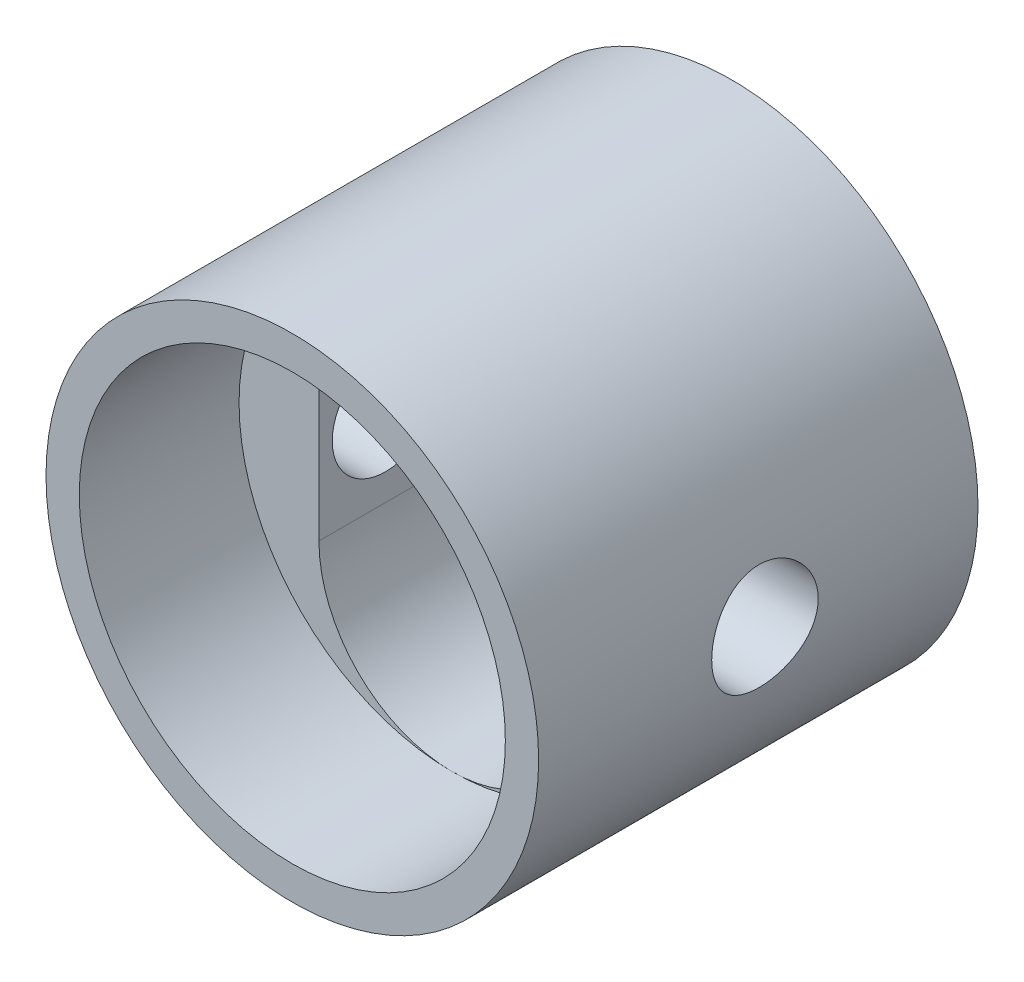
from build123d import *

# Parameters (mm, degrees)
ESQUISSE1_R             = 9.25
BASE_EXTRUSION_DEPTH    = 16.5
ESQUISSE2_R             = 2
ENL_V_MAT_EXTRU_1_DEPTH = 27.458694223
ESQUISSE3_R             = 8
ENL_V_MAT_EXTRU_2_DEPTH = 6
ENL_V_MAT_EXTRU_3_DEPTH = 10


with BuildPart() as part:
    # Esquisse1 → Base-Extrusion (new body)
    with BuildSketch(Plane.XY):
        Circle(ESQUISSE1_R)
    extrude(amount=BASE_EXTRUSION_DEPTH)

    # Esquisse2 → Enlèv. mat.-Extru.1 (cut, through all)
    with BuildSketch(Plane(origin=(9.25, 0, 0), x_dir=(0, 0, -1), z_dir=(1, 0, 0))):
        with Locations((-8, 0)):
            Circle(ESQUISSE2_R)
    extrude(amount=-ENL_V_MAT_EXTRU_1_DEPTH, mode=Mode.SUBTRACT)

    # Esquisse3 → Enlèv. mat.-Extru.2 (cut)
    with BuildSketch(Plane.XY.offset(16.5)):
        Circle(ESQUISSE3_R)
    extrude(amount=-ENL_V_MAT_EXTRU_2_DEPTH, mode=Mode.SUBTRACT)

    # Esquisse4 → Enlèv. mat.-Extru.3 (cut)
    with BuildSketch(Plane.XY.offset(10.5)):
        with BuildLine():
            Line((5, 3), (5, -3))
            ThreePointArc((5, -3), (0, -8), (-5, -3))
            Line((-5, -3), (-5, 3))
            ThreePointArc((-5, 3), (0, 8), (5, 3))
        make_face()
    extrude(amount=-ENL_V_MAT_EXTRU_3_DEPTH, mode=Mode.SUBTRACT)


solid = part.part
